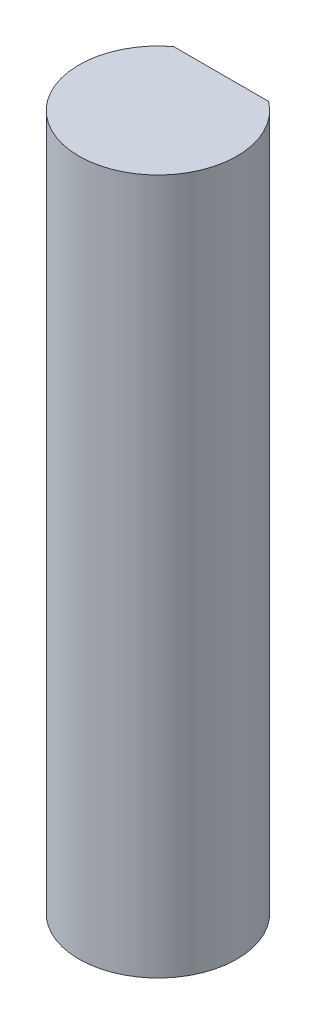
from build123d import *

# Parameters (mm, degrees)
SKETCH1_R           = 2.5
BOSS_EXTRUDE1_DEPTH = 22
CUT_EXTRUDE1_START  = -15
CUT_EXTRUDE1_DEPTH  = 15


with BuildPart() as part:
    # Sketch1 → Boss-Extrude1 (new body)
    with BuildSketch(Plane(origin=(0, 0, 0), x_dir=(1, 0, 0), z_dir=(0, 1, 0))):
        with Locations(Location((0, 0, 0), (0, 0, 270))):
            Circle(SKETCH1_R)
    extrude(amount=BOSS_EXTRUDE1_DEPTH)

    # Sketch2 → Cut-Extrude1 (cut)
    with BuildSketch(Plane(origin=(0, 22, 0), x_dir=(1, 0, 0), z_dir=(0, 1, 0)).offset(CUT_EXTRUDE1_START)):
        with BuildLine():
            ThreePointArc((1.5, 2), (0, 2.5), (-1.5, 2))
            Line((-1.5, 2), (1.5, 2))
        make_face()
    extrude(amount=CUT_EXTRUDE1_DEPTH, mode=Mode.SUBTRACT)


solid = part.part
